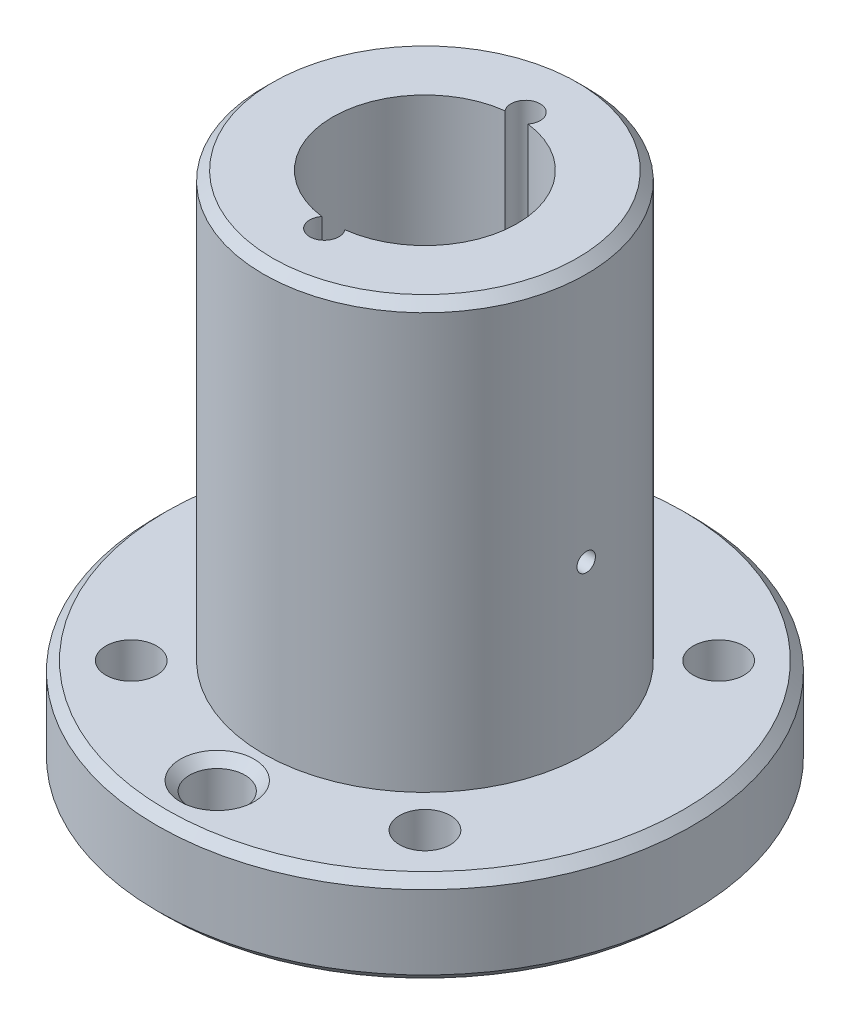
from build123d import *
from build123d.topology import SkipClean

# Parameters (mm, degrees)
SKETCH_1_R               = 29
EXTRUDE_1_DEPTH          = 10
SKETCH_2_R               = 17.5
EXTRUDE_2_DEPTH          = 56
SKETCH_3_R               = 10
CUT_EXTRUDE_1_DEPTH      = 56
CUT_EXTRUDE_2_REACH      = 71.412
SKETCH_4_R               = 2.75
SKETCH_4_R_2             = 3
SKETCH_4_4_R             = 4.75
SKETCH_4_4_R_2           = 2.75
CUT_EXTRUDE_3_DEPTH      = 5.4
SKETCH_3_3_R             = 10
SKETCH_3_3_R_2           = 1.585
CUT_EXTRUDE_4_DEPTH      = 56
CUT_EXTRUDE_5_DEPTH      = 70.411814556
CUT_EXTRUDE_5_DEPTH_BACK = 70.411814556
SKETCH_9_R               = 1
CUT_EXTRUDE_6_DEPTH      = 5.4
CHAMFER_1_SIZE           = 1
CHAMFER_2_SIZE           = 1
CHAMFER_3_SIZE           = 1


with BuildPart() as part:
    # 草图1 → 凸台-拉伸1 (new body)
    with BuildSketch(Plane(origin=(0, 0, 0), x_dir=(1, 0, 0), z_dir=(0, 1, 0))):
        with Locations(Location((0, 0, 0), (0, 0, 270))):
            Circle(SKETCH_1_R)
    extrude(amount=EXTRUDE_1_DEPTH)

    # 草图2 → 凸台-拉伸2 (add)
    with BuildSketch(Plane(origin=(0, 0, 0), x_dir=(1, 0, 0), z_dir=(0, 1, 0))):
        with Locations(Location((0, 0, 0), (0, 0, 270))):
            Circle(SKETCH_2_R)
    extrude(amount=EXTRUDE_2_DEPTH)

    # 草图3 → 切除-拉伸1 (cut)
    with BuildSketch(Plane(origin=(0, 0, 0), x_dir=(1, 0, 0), z_dir=(0, 1, 0))):
        with Locations(Location((0, 0, 0), (0, 0, 270))):
            Circle(SKETCH_3_R)
    extrude(amount=CUT_EXTRUDE_1_DEPTH, mode=Mode.SUBTRACT)

    # 草图4 → 切除-拉伸2 (cut, up to next)
    with BuildSketch(Plane.XZ, mode=Mode.PRIVATE) as cut_extrude_2_sk1:
        with Locations(Location((-15.909902577, 15.909902577, 0), (0, 0, 270))):
            Circle(SKETCH_4_R)
    cut_extrude_2_tool1 = extrude(cut_extrude_2_sk1.sketch, amount=-CUT_EXTRUDE_2_REACH, mode=Mode.PRIVATE) & part.part
    # 草图4 → 切除-拉伸2 (cut, up to next)
    with BuildSketch(Plane.XZ, mode=Mode.PRIVATE) as cut_extrude_2_sk2:
        with Locations(Location((-15.909902577, -15.909902577, 0), (0, 0, 270))):
            Circle(SKETCH_4_R)
    cut_extrude_2_tool2 = extrude(cut_extrude_2_sk2.sketch, amount=-CUT_EXTRUDE_2_REACH, mode=Mode.PRIVATE) & part.part
    # 草图4 → 切除-拉伸2 (cut, up to next)
    with BuildSketch(Plane.XZ, mode=Mode.PRIVATE) as cut_extrude_2_sk3:
        with Locations(Location((15.909902577, -15.909902577, 0), (0, 0, 270))):
            Circle(SKETCH_4_R)
    cut_extrude_2_tool3 = extrude(cut_extrude_2_sk3.sketch, amount=-CUT_EXTRUDE_2_REACH, mode=Mode.PRIVATE) & part.part
    # 草图4 → 切除-拉伸2 (cut, up to next)
    with BuildSketch(Plane.XZ, mode=Mode.PRIVATE) as cut_extrude_2_sk4:
        with Locations(Location((15.909902577, 15.909902577, 0), (0, 0, 270))):
            Circle(SKETCH_4_R)
    cut_extrude_2_tool4 = extrude(cut_extrude_2_sk4.sketch, amount=-CUT_EXTRUDE_2_REACH, mode=Mode.PRIVATE) & part.part
    # 草图4 → 切除-拉伸2 (cut, up to next)
    with BuildSketch(Plane.XZ, mode=Mode.PRIVATE) as cut_extrude_2_sk5:
        with Locations(Location((0, 22.5, 0), (0, 0, 270))):
            Circle(SKETCH_4_R_2)
    cut_extrude_2_tool5 = extrude(cut_extrude_2_sk5.sketch, amount=-CUT_EXTRUDE_2_REACH, mode=Mode.PRIVATE) & part.part
    add(cut_extrude_2_tool1.solids().sort_by_distance((-15.909903, 0, 15.909903))[0], mode=Mode.SUBTRACT)
    add(cut_extrude_2_tool2.solids().sort_by_distance((-15.909903, 0, -15.909903))[0], mode=Mode.SUBTRACT)
    add(cut_extrude_2_tool3.solids().sort_by_distance((15.909903, 0, -15.909903))[0], mode=Mode.SUBTRACT)
    add(cut_extrude_2_tool4.solids().sort_by_distance((15.909903, 0, 15.909903))[0], mode=Mode.SUBTRACT)
    add(cut_extrude_2_tool5.solids().sort_by_distance((0, 0, 22.5))[0], mode=Mode.SUBTRACT)

    # 草图4<4> → 切除-拉伸3 (cut)
    # profile 1 of 4: a face of its own
    with BuildSketch(Plane.XZ):
        with Locations(Location((-15.909902577, 15.909902577, 0), (0, 0, 270))):
            Circle(SKETCH_4_4_R)
        with Locations(Location((-15.909902577, 15.909902577, 0), (0, 0, 270))):
            Circle(SKETCH_4_4_R_2, mode=Mode.SUBTRACT)
    # profile 2 of 4: a face of its own
    with BuildSketch(Plane.XZ):
        with Locations(Location((15.909902577, 15.909902577, 0), (0, 0, 270))):
            Circle(SKETCH_4_4_R)
        with Locations(Location((15.909902577, 15.909902577, 0), (0, 0, 270))):
            Circle(SKETCH_4_4_R_2, mode=Mode.SUBTRACT)
    # profile 3 of 4: a face of its own
    with BuildSketch(Plane.XZ):
        with Locations(Location((15.909902577, -15.909902577, 0), (0, 0, 270))):
            Circle(SKETCH_4_4_R)
        with Locations(Location((15.909902577, -15.909902577, 0), (0, 0, 270))):
            Circle(SKETCH_4_4_R_2, mode=Mode.SUBTRACT)
    # profile 4 of 4: a face of its own
    with BuildSketch(Plane.XZ):
        with Locations(Location((-15.909902577, -15.909902577, 0), (0, 0, 270))):
            Circle(SKETCH_4_4_R)
        with Locations(Location((-15.909902577, -15.909902577, 0), (0, 0, 270))):
            Circle(SKETCH_4_4_R_2, mode=Mode.SUBTRACT)
    extrude(amount=-CUT_EXTRUDE_3_DEPTH, mode=Mode.SUBTRACT)

    # 草图3<3> → 切除-拉伸4 (cut)
    with BuildSketch(Plane(origin=(0, 0, 0), x_dir=(1, 0, 0), z_dir=(0, 1, 0))):
        Circle(SKETCH_3_3_R)
        with Locations((0, -10.9)):
            Circle(SKETCH_3_3_R_2)
        with Locations((0, 10.9)):
            Circle(SKETCH_3_3_R_2)
    extrude(amount=CUT_EXTRUDE_4_DEPTH, mode=Mode.SUBTRACT)

    # 草图9 → 切除-拉伸5 (cut, two sides: drawn at the far end of the back side and taken through both)
    with SkipClean():  # the faces are left unmerged after this step: merging them gives an invalid solid
        with BuildSketch(Plane(origin=(0, 0, 0), x_dir=(0, 0, -1), z_dir=(1, 0, 0)).offset(-CUT_EXTRUDE_5_DEPTH_BACK)):
            with Locations((0, 28)):
                Circle(SKETCH_9_R)
        extrude(amount=CUT_EXTRUDE_5_DEPTH + CUT_EXTRUDE_5_DEPTH_BACK, mode=Mode.SUBTRACT)

    # 草图11 → 切除-拉伸6 (cut)
    with BuildSketch(Plane(origin=(0, 0, 0), x_dir=(1, 0, 0), z_dir=(0, 1, 0))):
        with BuildLine():
            Line((-19.268659787, 12.551145366), (-15.26857459, 8.551060168))
            ThreePointArc((-15.26857459, 8.551060168), (-17.5, 0), (-15.26857459, -8.551060168))
            Line((-15.26857459, -8.551060168), (-19.268659787, -12.551145366))
            Line((-19.268659787, -12.551145366), (-12.551145366, -19.268659787))
            Line((-12.551145366, -19.268659787), (-8.551060168, -15.26857459))
            ThreePointArc((-8.551060168, -15.26857459), (0, -17.5), (8.551060168, -15.26857459))
            Line((8.551060168, -15.26857459), (12.551145366, -19.268659787))
            Line((12.551145366, -19.268659787), (19.268659787, -12.551145366))
            Line((19.268659787, -12.551145366), (15.26857459, -8.551060168))
            ThreePointArc((15.26857459, -8.551060168), (17.5, 0), (15.26857459, 8.551060168))
            Line((15.26857459, 8.551060168), (19.268659787, 12.551145366))
            Line((19.268659787, 12.551145366), (12.551145366, 19.268659787))
            Line((12.551145366, 19.268659787), (8.551060168, 15.26857459))
            ThreePointArc((8.551060168, 15.26857459), (0, 17.5), (-8.551060168, 15.26857459))
            Line((-8.551060168, 15.26857459), (-12.551145366, 19.268659787))
            Line((-12.551145366, 19.268659787), (-19.268659787, 12.551145366))
        make_face()
    extrude(amount=CUT_EXTRUDE_6_DEPTH, mode=Mode.SUBTRACT)

    # 倒角1
    chamfer_1_edges = [part.edges().sort_by_distance(p)[0] for p in [
        (0, 0, -29),
        (0, 10, -29),
        (0, 56, -17.5),
    ]]
    chamfer(chamfer_1_edges, length=CHAMFER_1_SIZE)

    # 倒角2
    chamfer_2_edges = [part.edges().sort_by_distance(p)[0] for p in [
        (0, 0, 25.5),
    ]]
    chamfer(chamfer_2_edges, length=CHAMFER_2_SIZE)

    # 倒角3
    chamfer_3_edges = [part.edges().sort_by_distance(p)[0] for p in [
        (0, 10, 25.5),
    ]]
    chamfer(chamfer_3_edges, length=CHAMFER_3_SIZE)


solid = part.part
